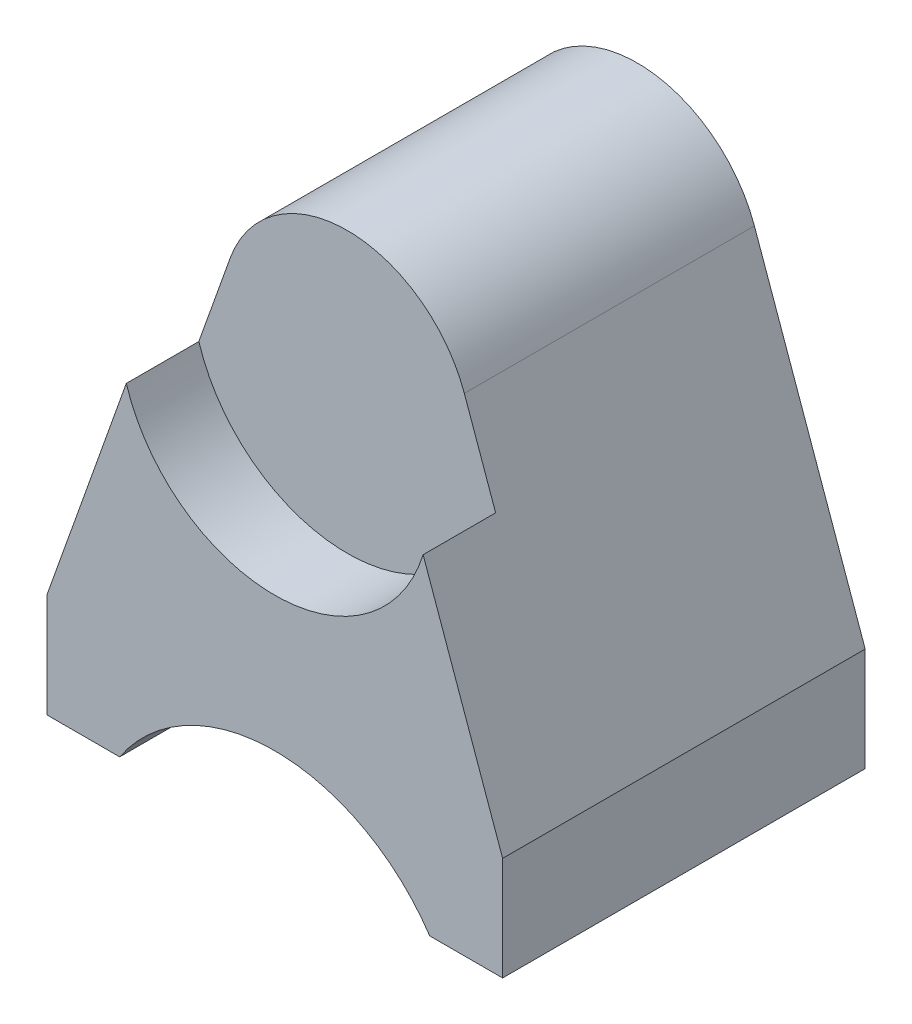
from build123d import *

# Parameters (mm, degrees)
SALIENTE_EXTRUIR1_DEPTH = 17.5
CROQUIS2_R              = 15
CORTAR_EXTRUIR1_DEPTH   = 7


with BuildPart() as part:
    # Croquis1 → Saliente-Extruir1 (new, symmetric)
    with BuildSketch(Plane.XY):
        with BuildLine():
            Line((-14.966629547, 0), (-22, 0))
            Line((-22, 0), (-22, 10))
            Line((-22, 10), (-11.304244422, 40.026668357))
            ThreePointArc((-11.304244422, 40.026668357), (0, 48), (11.304244422, 40.026668357))
            Line((11.304244422, 40.026668357), (22, 10))
            Line((22, 10), (22, 0))
            Line((22, 0), (14.966629547, 0))
            ThreePointArc((14.966629547, 0), (0, 8), (-14.966629547, 0))
        make_face()
    extrude(amount=SALIENTE_EXTRUIR1_DEPTH, both=True)

    # Croquis2 → Cortar-Extruir1 (cut)
    with BuildSketch(Plane.XY.offset(17.5)):
        with Locations((0, 36)):
            Circle(CROQUIS2_R)
    extrude(amount=-CORTAR_EXTRUIR1_DEPTH, mode=Mode.SUBTRACT)


solid = part.part
